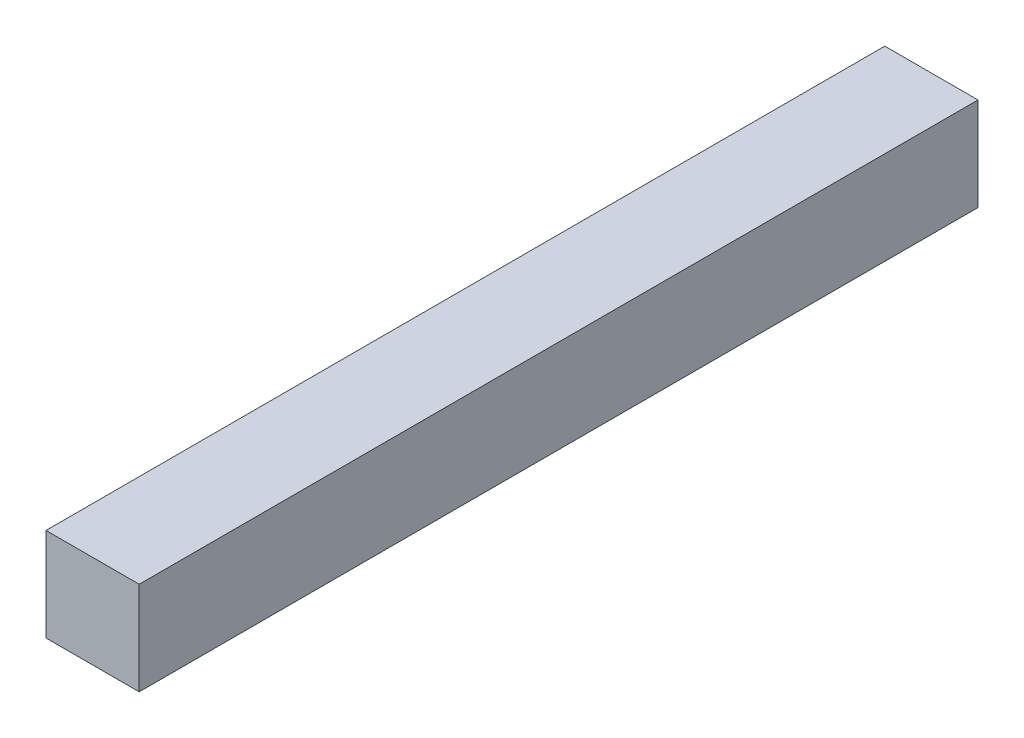
from build123d import *

# Parameters (mm, degrees)
SKETCH2_W           = 2.54
SKETCH2_H           = 2.54
BOSS_EXTRUDE1_DEPTH = 22.86


with BuildPart() as part:
    # Sketch2 → Boss-Extrude1 (new body)
    with BuildSketch(Plane.XY):
        with Locations((-1.27, 1.27)):
            Rectangle(SKETCH2_W, SKETCH2_H)
    extrude(amount=BOSS_EXTRUDE1_DEPTH)


solid = part.part
